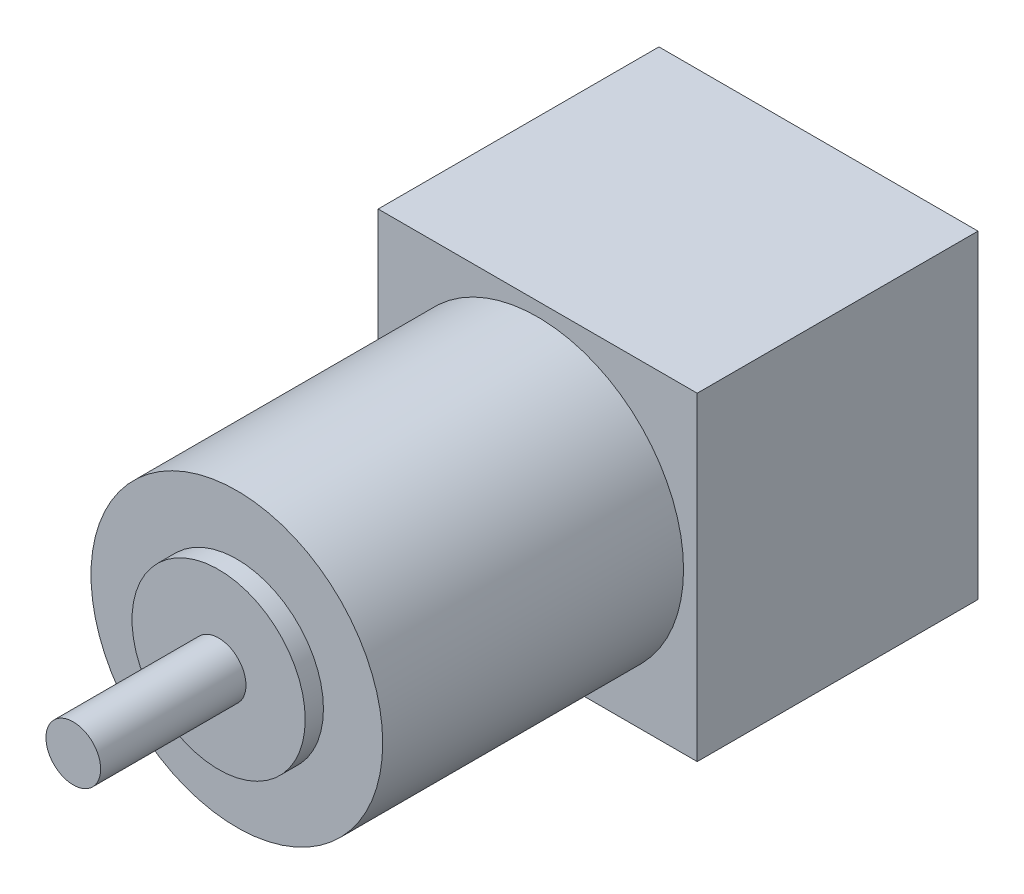
from build123d import *

# Parameters (mm, degrees)
SKETCH1_W           = 35
SKETCH1_H           = 35
BOSS_EXTRUDE1_DEPTH = 30.8
SKETCH2_R           = 16
BOSS_EXTRUDE2_DEPTH = 33
SKETCH4_R           = 9.5
BOSS_EXTRUDE4_DEPTH = 2
SKETCH3_R           = 3
BOSS_EXTRUDE3_DEPTH = 15.94


with BuildPart() as part:
    # Sketch1 → Boss-Extrude1 (new body)
    with BuildSketch(Plane.XY):
        Rectangle(SKETCH1_W, SKETCH1_H)
    extrude(amount=BOSS_EXTRUDE1_DEPTH)

    # Sketch2 → Boss-Extrude2 (add)
    with BuildSketch(Plane.XY.offset(30.8)):
        Circle(SKETCH2_R)
    extrude(amount=BOSS_EXTRUDE2_DEPTH)

    # Sketch4 → Boss-Extrude4 (add)
    with BuildSketch(Plane.XY.offset(63.8)):
        Circle(SKETCH4_R)
    extrude(amount=BOSS_EXTRUDE4_DEPTH)

    # Sketch3 → Boss-Extrude3 (add)
    with BuildSketch(Plane.XY.offset(65.8)):
        Circle(SKETCH3_R)
    extrude(amount=BOSS_EXTRUDE3_DEPTH)


solid = part.part
